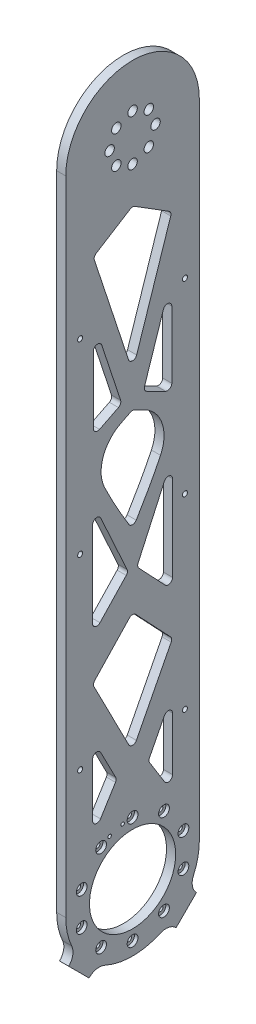
from build123d import *

# Parameters (mm, degrees)
SKETCH1_R                            = 3.3
SKETCH1_R_2                          = 1.7
SKETCH1_R_3                          = 26
BOSS_EXTRUDE1_DEPTH                  = 6.35
CUT_EXTRUDE1_DEPTH                   = 549.511460682
FILLET1_R                            = 3
SKETCH4_R                            = 1.75
CUT_EXTRUDE2_DEPTH                   = 549.511460792
SKETCH5_R                            = 1.2
CUT_EXTRUDE4_DEPTH                   = 549.511460792
BOSS_EXTRUDE2_START                  = -6.35
BOSS_EXTRUDE2_DEPTH                  = 6.35
TAP_DRILL_FOR_M3X0_5_TAP1_AT_2_COUNT = 2
TAP_DRILL_FOR_M3X0_5_TAP1_AT_2_PITCH = 13.03070812
CIRPATTERN1_COUNT                    = 2
CIRPATTERN1_ANGLE                    = 90
CUT_EXTRUDE5_DEPTH                   = 549.511460792
SKETCH10_R                           = 30
CUT_EXTRUDE6_DEPTH                   = 549.511460792
SKETCH11_W                           = 93
SKETCH11_H                           = 52.717688801
CUT_EXTRUDE7_DEPTH                   = 549.511460792
BOSS_EXTRUDE3_DEPTH                  = 6.35
SKETCH13_R                           = 1.75
CUT_EXTRUDE8_DEPTH                   = 549.511460792
SKETCH14_R                           = 1.75
BOSS_EXTRUDE4_DEPTH                  = 6.35
BOSS_EXTRUDE5_DEPTH                  = 6.35
M3X0_5_TAPPED_HOLE1_AT_2_COUNT       = 2
M3X0_5_TAPPED_HOLE1_AT_2_PITCH       = 12.5
CIRPATTERN2_COUNT                    = 2
CIRPATTERN2_ANGLE                    = 90
FILLET2_R                            = 10
SKETCH19_R                           = 3.75
SHALLOW_COUNTERBORES_DEPTH           = 2.5
SHALLOW_COUNTERBORES_2_COUNT         = 10


with BuildPart() as part:
    # Sketch1 → Boss-Extrude1 (new body)
    with BuildSketch(Plane(origin=(0, 0, 0), x_dir=(0, -1, 0), z_dir=(1, 0, 0))):
        with BuildLine():
            Line((0, 46.5), (500, 46.5))
            ThreePointArc((500, 46.5), (546.5, 0), (500, -46.5))
            Line((500, -46.5), (0, -46.5))
            ThreePointArc((0, -46.5), (-46.5, 0), (0, 46.5))
        make_face()
        with Locations(Location((-16, 0, 0), (0, 0, 90))):
            Circle(SKETCH1_R, mode=Mode.SUBTRACT)
        with Locations(Location((-11.313708499, 11.313708499, 0), (0, 0, 90))):
            Circle(SKETCH1_R, mode=Mode.SUBTRACT)
        with Locations(Location((0, 16, 0), (0, 0, 90))):
            Circle(SKETCH1_R, mode=Mode.SUBTRACT)
        with Locations(Location((11.313708499, 11.313708499, 0), (0, 0, 90))):
            Circle(SKETCH1_R, mode=Mode.SUBTRACT)
        with Locations(Location((16, 0, 0), (0, 0, 90))):
            Circle(SKETCH1_R, mode=Mode.SUBTRACT)
        with Locations(Location((11.313708499, -11.313708499, 0), (0, 0, 90))):
            Circle(SKETCH1_R, mode=Mode.SUBTRACT)
        with Locations(Location((537.25, 0, 0), (0, 0, 90))):
            Circle(SKETCH1_R_2, mode=Mode.SUBTRACT)
        with Locations(Location((530.13588304, -21.895000648, 0), (0, 0, 90))):
            Circle(SKETCH1_R_2, mode=Mode.SUBTRACT)
        with Locations(Location((511.51088304, -35.426855232, 0), (0, 0, 90))):
            Circle(SKETCH1_R_2, mode=Mode.SUBTRACT)
        with Locations(Location((488.48911696, -35.426855232, 0), (0, 0, 90))):
            Circle(SKETCH1_R_2, mode=Mode.SUBTRACT)
        with Locations(Location((469.86411696, -21.895000648, 0), (0, 0, 90))):
            Circle(SKETCH1_R_2, mode=Mode.SUBTRACT)
        with Locations(Location((462.75, 0, 0), (0, 0, 90))):
            Circle(SKETCH1_R_2, mode=Mode.SUBTRACT)
        with Locations(Location((469.86411696, 21.895000648, 0), (0, 0, 90))):
            Circle(SKETCH1_R_2, mode=Mode.SUBTRACT)
        with Locations(Location((488.48911696, 35.426855232, 0), (0, 0, 90))):
            Circle(SKETCH1_R_2, mode=Mode.SUBTRACT)
        with Locations(Location((511.51088304, 35.426855232, 0), (0, 0, 90))):
            Circle(SKETCH1_R_2, mode=Mode.SUBTRACT)
        with Locations(Location((530.13588304, 21.895000648, 0), (0, 0, 90))):
            Circle(SKETCH1_R_2, mode=Mode.SUBTRACT)
        with Locations(Location((500, 0, 0), (0, 0, 90))):
            Circle(SKETCH1_R_3, mode=Mode.SUBTRACT)
        with Locations(Location((0, -16, 0), (0, 0, 90))):
            Circle(SKETCH1_R, mode=Mode.SUBTRACT)
        with Locations(Location((-11.313708499, -11.313708499, 0), (0, 0, 90))):
            Circle(SKETCH1_R, mode=Mode.SUBTRACT)
    extrude(amount=BOSS_EXTRUDE1_DEPTH)

    # Sketch3 → Cut-Extrude1 (cut, through all)
    with BuildSketch(Plane(origin=(6.35, 0, 0), x_dir=(0, 0, -1), z_dir=(1, 0, 0))):
        Polygon((0, -422.848022722), (27.858212922, -368.632839363), (0, -339.139268075), (-27.858212922, -368.632839363), align=None)
        Polygon((0, -41.368651369), (-27.312924288, -58.435222232), (0, -141.248998295), (27.312924288, -58.435222232), align=None)
        Polygon((3, -313.189087212), (27.858212922, -339.506549748), (27.858212922, -258.646044282), align=None)
        Polygon((-27.858212922, -339.506549748), (-27.858212922, -258.646044282), (-3, -313.189087212), align=None)
        Polygon((-27.858212922, -401.452857349), (-11, -434.260816252), (-27.858212922, -461.481824785), align=None)
        Polygon((11, -434.260816252), (27.858212922, -461.481824785), (27.858212922, -401.452857349), align=None)
        with BuildLine():
            Line((0, -164.248853344), (-27.858212922, -178.200474573))
            add(Edge.make_bspline(
                [(-27.858212922, -178.200474573), (-43.7790539, -216.093343216), (-18.61661693, -258.276071598), (0, -289.085024731)],
                knots=[0, 0, 0, 0, 1, 1, 1, 1], degree=3))
            add(Edge.make_bspline(
                [(27.858212922, -178.200474573), (43.7790539, -216.093343216), (18.61661693, -258.276071598), (0, -289.085024731)],
                knots=[0, 0, 0, 0, 1, 1, 1, 1], degree=3))
            Line((27.858212922, -178.200474573), (0, -164.248853344))
        make_face()
        Polygon((7.5, -156.820958214), (27.312924288, -96.747453897), (27.312924288, -166.743432993), align=None)
        Polygon((-27.312924288, -96.747453897), (-27.312924288, -166.743432993), (-7.5, -156.820958214), align=None)
    extrude(amount=-CUT_EXTRUDE1_DEPTH, mode=Mode.SUBTRACT)

    # Fillet1
    fillet1_edges = [part.edges().sort_by_distance(p)[0] for p in [
        (3.175, -58.435222232, -27.312924288),
        (3.175, -41.368651369, 0),
        (3.175, -58.435222232, 27.312924288),
        (3.175, -141.248998295, 0),
        (3.175, -289.085024731, 0),
        (3.175, -164.248853344, 0),
        (3.175, -401.452857349, 27.858212922),
        (3.175, -434.260816252, 11),
        (3.175, -461.481824785, 27.858212922),
        (3.175, -461.481824785, -27.858212922),
        (3.175, -434.260816252, -11),
        (3.175, -401.452857349, -27.858212922),
        (3.175, -368.632839363, -27.858212922),
        (3.175, -339.139268075, 0),
        (3.175, -368.632839363, 27.858212922),
        (3.175, -422.848022722, 0),
        (3.175, -313.189087212, 3),
        (3.175, -339.506549748, 27.858212922),
        (3.175, -258.646044282, 27.858212922),
        (3.175, -178.200474573, -27.858212922),
        (3.175, -178.200474573, 27.858212922),
        (3.175, -339.506549748, -27.858212922),
        (3.175, -313.189087212, -3),
        (3.175, -258.646044282, -27.858212922),
        (3.175, -96.747453897, 27.312924288),
        (3.175, -166.743432993, 27.312924288),
        (3.175, -156.820958214, 7.5),
        (3.175, -166.743432993, -27.312924288),
        (3.175, -156.820958214, -7.5),
        (3.175, -96.747453897, -27.312924288),
    ]]
    fillet(fillet1_edges, radius=FILLET1_R)

    # Sketch4 → Cut-Extrude2 (cut, through all)
    with BuildSketch(Plane(origin=(6.35, 0, 0), x_dir=(0, 0, -1), z_dir=(1, 0, 0))):
        with Locations((-36.5, -103.175)):
            Circle(SKETCH4_R)
        with Locations(Location((36.5, -103.175, 0), (0, 0, 180))):
            Circle(SKETCH4_R)
        with Locations(Location((-36.5, -259.525, 0), (0, 0, 180))):
            Circle(SKETCH4_R)
        with Locations((36.5, -259.525)):
            Circle(SKETCH4_R)
        with Locations((-36.5, -415.875)):
            Circle(SKETCH4_R)
        with Locations(Location((36.5, -415.875, 0), (0, 0, 180))):
            Circle(SKETCH4_R)
    extrude(amount=-CUT_EXTRUDE2_DEPTH, mode=Mode.SUBTRACT)

    # Sketch5 → Cut-Extrude4 (cut, through all)
    with BuildSketch(Plane(origin=(6.35, 0, 0), x_dir=(0, 0, -1), z_dir=(1, 0, 0))):
        with Locations((-6.916110339, -463.343078174)):
            Circle(SKETCH5_R)
        with Locations((-15.951147244, -466.27873962)):
            Circle(SKETCH5_R)
    extrude(amount=-CUT_EXTRUDE4_DEPTH, mode=Mode.SUBTRACT)

    # Sketch6 → Boss-Extrude2 (add)
    with BuildSketch(Plane(origin=(6.35, 0, 0), x_dir=(0, 0, -1), z_dir=(1, 0, 0)).offset(BOSS_EXTRUDE2_START)):
        with BuildLine():
            Line((-44.110383395, -529.968247771), (-29.968247771, -544.110383395))
            ThreePointArc((-29.968247771, -544.110383395), (-23.286397782, -542.399293624), (-16.474718596, -543.483717035))
            ThreePointArc((-16.474718596, -543.483717035), (-32.880465325, -532.880465325), (-43.483717035, -516.474718596))
            ThreePointArc((-43.483717035, -516.474718596), (-42.399293624, -523.286397782), (-44.110383395, -529.968247771))
        make_face()
    boss_extrude2 = extrude(amount=BOSS_EXTRUDE2_DEPTH)

    # Sketch8 → Tap Drill for M3x0.5 Tap1 (revolve, cut)
    with BuildSketch(Plane(origin=(3.175, -532.796674896, 41.28195627), x_dir=(0, -0.7071067811865424, -0.7071067811865527), z_dir=(1, 0, 0))):
        Polygon((0, 0), (0, 5.751075774), (1.25, 5), (1.25, 0), align=None)
    tap_drill_for_m3x0_5_tap1 = revolve(axis=Axis((3.175, -537.286802956, 45.772084331), (0, 0.7071067811865529, -0.7071067811865422)), mode=Mode.SUBTRACT)

    # Tap Drill for M3x0.5 Tap1 at 2: Tap Drill for M3x0.5 Tap1 ×2
    with Locations(*[Vector(0, -0.7071067811865422, -0.7071067811865529) * (i * TAP_DRILL_FOR_M3X0_5_TAP1_AT_2_PITCH) for i in range(1, TAP_DRILL_FOR_M3X0_5_TAP1_AT_2_COUNT)]):
        add(tap_drill_for_m3x0_5_tap1, mode=Mode.SUBTRACT)

    # CirPattern1: Boss-Extrude2, Tap Drill for M3x0.5 Tap1 ×2 about axis
    cirpattern1_axis = Axis((0, -500, 0), (1, 0, 0))
    add([boss_extrude2.rotate(cirpattern1_axis, i * CIRPATTERN1_ANGLE / (CIRPATTERN1_COUNT - 1)) for i in range(1, CIRPATTERN1_COUNT)])
    add([tap_drill_for_m3x0_5_tap1.rotate(cirpattern1_axis, i * CIRPATTERN1_ANGLE / (CIRPATTERN1_COUNT - 1)) for i in range(1, CIRPATTERN1_COUNT)], mode=Mode.SUBTRACT)

    # CirPattern1 copy 1 sketch → CirPattern1 copy 1 (revolve, cut)
    with BuildSketch(Plane(origin=(3.175, -532.067854195, -42.010776971), x_dir=(0, 0.7071067811865551, -0.7071067811865399), z_dir=(1, 0, 0))):
        Polygon((0, 0), (0, 5.751075774), (1.25, 5), (1.25, 0), align=None)
    revolve(axis=Axis((3.175, -536.557982255, -46.500905032), (0, 0.7071067811865398, 0.7071067811865553)), mode=Mode.SUBTRACT)

    # Sketch9 → Cut-Extrude5 (cut, through all)
    with BuildSketch(Plane(origin=(6.35, 0, 0), x_dir=(0, 0, -1), z_dir=(1, 0, 0))):
        with BuildLine():
            Line((-43.483717035, -516.474718596), (-63.483717035, -516.474718596))
            ThreePointArc((-63.483717035, -516.474718596), (0, -565.586573942), (63.483717035, -516.474718596))
            Line((63.483717035, -516.474718596), (43.483717035, -516.474718596))
            ThreePointArc((43.483717035, -516.474718596), (0, -546.5), (-43.483717035, -516.474718596))
        make_face()
    extrude(amount=-CUT_EXTRUDE5_DEPTH, mode=Mode.SUBTRACT)

    # Sketch10 → Cut-Extrude6 (cut, through all)
    with BuildSketch(Plane(origin=(6.35, 0, 0), x_dir=(0, 0, -1), z_dir=(1, 0, 0))):
        with Locations((0, -500)):
            Circle(SKETCH10_R)
    extrude(amount=-CUT_EXTRUDE6_DEPTH, mode=Mode.SUBTRACT)

    # Sketch11 → Cut-Extrude7 (cut, through all)
    with BuildSketch(Plane.ZY):
        with Locations((0, -205.625859872)):
            Rectangle(SKETCH11_W, SKETCH11_H)
    extrude(amount=-CUT_EXTRUDE7_DEPTH, mode=Mode.SUBTRACT)


with BuildPart() as cut_extrude7_piece_1:
    # of the separate pieces the step leaves, piece 1, a body of its own (cut_extrude7_pieces)
    add(part.part.solids().sort_by_distance((0, -500, 46.5))[0])


with BuildPart() as cut_extrude7_piece_2:
    # of the separate pieces the step leaves, piece 2, a body of its own (cut_extrude7_pieces)
    add(part.part.solids().sort_by_distance((0, -179.267015471, 46.5))[0])


with BuildPart() as cut_extrude7_piece_2_1:
    # Body-Move/Copy1: moved
    add(cut_extrude7_piece_2.part.moved(Location((0, -52.7176888, 0))))

    # Combine1: union Cut-Extrude7 piece 1
    add(cut_extrude7_piece_1.part)

    # Sketch12 → Boss-Extrude3 (add)
    with BuildSketch(Plane.ZY):
        with BuildLine():
            Line((-8.107077378, -221.026632904), (-26.8521577, -230.414322677))
            ThreePointArc((-26.8521577, -230.414322677), (-27.717865763, -231.066969848), (-28.295067899, -231.984704273))
            add(Edge.make_bspline(
                [(-19.477332048, -254.141993575), (-22.908456866, -246.947780666), (-25.966776611, -239.522857913), (-28.295067899, -231.984704273)],
                knots=[0.341715687, 0.341715687, 0.341715687, 0.341715687, 0.53746001, 0.53746001, 0.53746001, 0.53746001], degree=3))
            ThreePointArc((-19.477332048, -254.141993575), (-20.557337263, -235.261485452), (-8.107077378, -221.026632904))
        make_face()
        with BuildLine():
            Line((8.107077378, -221.026632904), (26.8521577, -230.414322677))
            ThreePointArc((26.8521577, -230.414322677), (27.717865763, -231.066969847), (28.295067899, -231.984704271))
            add(Edge.make_bspline(
                [(28.295067899, -231.984704271), (25.966776612, -239.522857912), (22.908456866, -246.947780666), (19.477332048, -254.141993575)],
                knots=[0.46253999, 0.46253999, 0.46253999, 0.46253999, 0.658284313, 0.658284313, 0.658284313, 0.658284313], degree=3))
            ThreePointArc((19.477332048, -254.141993575), (20.557337263, -235.261485452), (8.107077378, -221.026632904))
        make_face()
    extrude(amount=-BOSS_EXTRUDE3_DEPTH)

    # Sketch13 → Cut-Extrude8 (cut, through all)
    with BuildSketch(Plane.ZY):
        with Locations((-36.5, -285.8838444)):
            Circle(SKETCH13_R)
        with Locations((36.5, -285.8838444)):
            Circle(SKETCH13_R)
    extrude(amount=-CUT_EXTRUDE8_DEPTH, mode=Mode.SUBTRACT)

    # Sketch14 → Boss-Extrude4 (add)
    with BuildSketch(Plane(origin=(6.35, 0, 0), x_dir=(0, 0, -1), z_dir=(1, 0, 0))):
        with Locations((36.5, -259.525)):
            Circle(SKETCH14_R)
        with Locations((-36.5, -259.525)):
            Circle(SKETCH14_R)
    extrude(amount=-BOSS_EXTRUDE4_DEPTH)

    # Sketch15 → Boss-Extrude5 (add)
    with BuildSketch(Plane.ZY):
        Polygon((-30.343368187, -544.485503811), (-25.040067328, -539.182202952), (-39.182202952, -525.040067328), (-44.485503811, -530.343368187), align=None)
        Polygon((30.343368187, -544.485503811), (44.485503811, -530.343368187), (39.182202952, -525.040067328), (25.040067328, -539.182202952), align=None)
    extrude(amount=-BOSS_EXTRUDE5_DEPTH)

    # Sketch17 → M3x0.5 Tapped Hole1 (revolve, cut)
    with BuildSketch(Plane(origin=(3.175, -532.995018617, -41.833853382), x_dir=(0, 0.7071067811865476, -0.7071067811865476), z_dir=(1, 0, 0))):
        Polygon((0, 0), (0, 8.251075774), (1.25, 7.5), (1.25, 0), align=None)
    m3x0_5_tapped_hole1 = revolve(axis=Axis((3.175, -537.485146677, -46.323981442), (0, 0.7071067811865472, 0.7071067811865478)), mode=Mode.SUBTRACT)

    # M3x0.5 Tapped Hole1 at 2: M3x0.5 Tapped Hole1 ×2
    with Locations(*[Vector(0, -0.707106781186548, 0.7071067811865471) * (i * M3X0_5_TAPPED_HOLE1_AT_2_PITCH) for i in range(1, M3X0_5_TAPPED_HOLE1_AT_2_COUNT)]):
        add(m3x0_5_tapped_hole1, mode=Mode.SUBTRACT)

    # CirPattern2: M3x0.5 Tapped Hole1 ×2 about axis
    cirpattern2_axis = Axis((0, -500, 0), (-1, 0, 0))
    for i in range(1, CIRPATTERN2_COUNT):
        add(m3x0_5_tapped_hole1.rotate(cirpattern2_axis, i * CIRPATTERN2_ANGLE / (CIRPATTERN2_COUNT - 1)), mode=Mode.SUBTRACT)

    # CirPattern2 copy 1 sketch → CirPattern2 copy 1 (revolve, cut)
    with BuildSketch(Plane(origin=(3.175, -532.995018617, 41.833853382), x_dir=(0, -0.70710678118655, -0.7071067811865451), z_dir=(1, 0, 0))):
        Polygon((0, 0), (0, 8.251075774), (1.25, 7.5), (1.25, 0), align=None)
    revolve(axis=Axis((3.175, -537.485146677, 46.323981442), (0, 0.7071067811865454, -0.7071067811865497)), mode=Mode.SUBTRACT)

    # Fillet2
    fillet2_edges = [cut_extrude7_piece_2_1.edges().sort_by_distance(p)[0] for p in [
        (3.175, -539.182202952, -25.040067328),
        (3.175, -525.040067328, -39.182202952),
        (3.175, -525.040067328, 39.182202952),
        (3.175, -539.182202952, 25.040067328),
    ]]
    fillet(fillet2_edges, radius=FILLET2_R)

    # Sketch19 → shallow_counterbores (cut)
    with BuildSketch(Plane(origin=(6.35, 0, 0), x_dir=(0, 0, -1), z_dir=(1, 0, 0))):
        with Locations((0, -537.25)):
            Circle(SKETCH19_R)
    shallow_counterbores = extrude(amount=-SHALLOW_COUNTERBORES_DEPTH, mode=Mode.SUBTRACT)

    # shallow_counterbores_2: shallow_counterbores ×10 about axis
    shallow_counterbores_2_axis = Axis((0, -500, 0), (1, 0, 0))
    for i in range(1, SHALLOW_COUNTERBORES_2_COUNT):
        add(shallow_counterbores.rotate(shallow_counterbores_2_axis, i * 360 / SHALLOW_COUNTERBORES_2_COUNT), mode=Mode.SUBTRACT)


solid = cut_extrude7_piece_2_1.part
